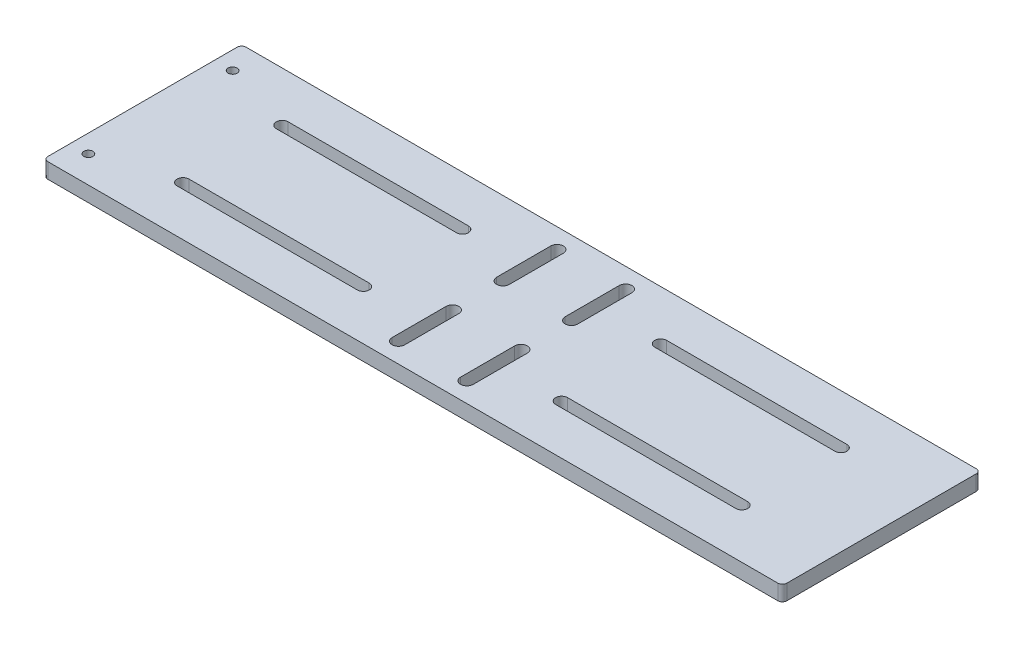
from build123d import *

# Parameters (mm, degrees)
SKETCH1_W            = 410
SKETCH1_H            = 110
BOSS_EXTRUDE1_DEPTH  = 8.5
M4_CLEARANCE_HOLE1_D = 5
M6_CLEARANCE_HOLE1_D = 7
FILLET1_R            = 2.5
CUT_EXTRUDE1_DEPTH   = 8.5
CUT_EXTRUDE2_DEPTH   = 8.5


with BuildPart() as part:
    # Sketch1 → Boss-Extrude1 (new body)
    with BuildSketch(Plane(origin=(0, 0, 0), x_dir=(1, 0, 0), z_dir=(0, 1, 0))):
        Rectangle(SKETCH1_W, SKETCH1_H)
    extrude(amount=BOSS_EXTRUDE1_DEPTH)

    # M4 Clearance Hole1 (through all)
    with Locations(Plane(origin=(0, 8.5, 0), x_dir=(1, 0, 0), z_dir=(0, 1, 0))):
        with Locations((-195, -40), (-195, 40)):
            Hole(M4_CLEARANCE_HOLE1_D / 2)

    # M6 Clearance Hole1 (through all)
    with Locations(Plane(origin=(0, 8.5, 0), x_dir=(1, 0, 0), z_dir=(0, 1, 0))):
        with Locations((19, 34), (19, -34), (-19, -34), (-19, 34)):
            Hole(M6_CLEARANCE_HOLE1_D / 2)

    # Fillet1
    fillet1_edges = [part.edges().sort_by_distance(p)[0] for p in [
        (205, 4.25, 55),
        (-205, 4.25, 55),
        (-205, 4.25, -55),
        (205, 4.25, -55),
    ]]
    fillet(fillet1_edges, radius=FILLET1_R)

    # Sketch6 → Cut-Extrude1 (cut)
    with BuildSketch(Plane(origin=(0, 8.5, 0), x_dir=(1, 0, 0), z_dir=(0, 1, 0))):
        with BuildLine():
            Line((-22.5, 34), (-22.5, 14))
            ThreePointArc((-22.5, 14), (-19, 10.5), (-15.5, 14))
            Line((-15.5, 14), (-15.5, 34))
            Line((-15.5, 34), (-15.5, 44))
            ThreePointArc((-15.5, 44), (-19, 47.5), (-22.5, 44))
            Line((-22.5, 44), (-22.5, 34))
        make_face()
        with BuildLine():
            Line((22.5, 34), (22.5, 14))
            ThreePointArc((22.5, 14), (19, 10.5), (15.5, 14))
            Line((15.5, 14), (15.5, 34))
            Line((15.5, 34), (15.5, 44))
            ThreePointArc((15.5, 44), (19, 47.5), (22.5, 44))
            Line((22.5, 44), (22.5, 34))
        make_face()
        with BuildLine():
            Line((-22.5, -44), (-22.5, -34))
            Line((-22.5, -34), (-22.5, -14))
            ThreePointArc((-22.5, -14), (-19, -10.5), (-15.5, -14))
            Line((-15.5, -14), (-15.5, -34))
            Line((-15.5, -34), (-15.5, -44))
            ThreePointArc((-15.5, -44), (-19, -47.5), (-22.5, -44))
        make_face()
        with BuildLine():
            Line((15.5, -44), (15.5, -34))
            Line((15.5, -34), (15.5, -14))
            ThreePointArc((15.5, -14), (19, -10.5), (22.5, -14))
            Line((22.5, -14), (22.5, -34))
            Line((22.5, -34), (22.5, -44))
            ThreePointArc((22.5, -44), (19, -47.5), (15.5, -44))
        make_face()
    extrude(amount=-CUT_EXTRUDE1_DEPTH, mode=Mode.SUBTRACT)

    # Sketch7 → Cut-Extrude2 (cut)
    with BuildSketch(Plane(origin=(0, 8.5, 0), x_dir=(1, 0, 0), z_dir=(0, 1, 0))):
        with BuildLine():
            Line((-155, 30.8), (-55, 30.8))
            ThreePointArc((-55, 30.8), (-51.7, 27.5), (-55, 24.2))
            Line((-55, 24.2), (-155, 24.2))
            ThreePointArc((-155, 24.2), (-158.3, 27.5), (-155, 30.8))
        make_face()
        with BuildLine():
            Line((-155, -24.2), (-55, -24.2))
            ThreePointArc((-55, -24.2), (-51.7, -27.5), (-55, -30.8))
            Line((-55, -30.8), (-155, -30.8))
            ThreePointArc((-155, -30.8), (-158.3, -27.5), (-155, -24.2))
        make_face()
        with BuildLine():
            Line((55, -24.2), (155, -24.2))
            ThreePointArc((155, -24.2), (158.3, -27.5), (155, -30.8))
            Line((155, -30.8), (55, -30.8))
            ThreePointArc((55, -30.8), (51.7, -27.5), (55, -24.2))
        make_face()
        with BuildLine():
            Line((155, 30.8), (55, 30.8))
            ThreePointArc((55, 30.8), (51.7, 27.5), (55, 24.2))
            Line((55, 24.2), (155, 24.2))
            ThreePointArc((155, 24.2), (158.3, 27.5), (155, 30.8))
        make_face()
    extrude(amount=-CUT_EXTRUDE2_DEPTH, mode=Mode.SUBTRACT)


solid = part.part
